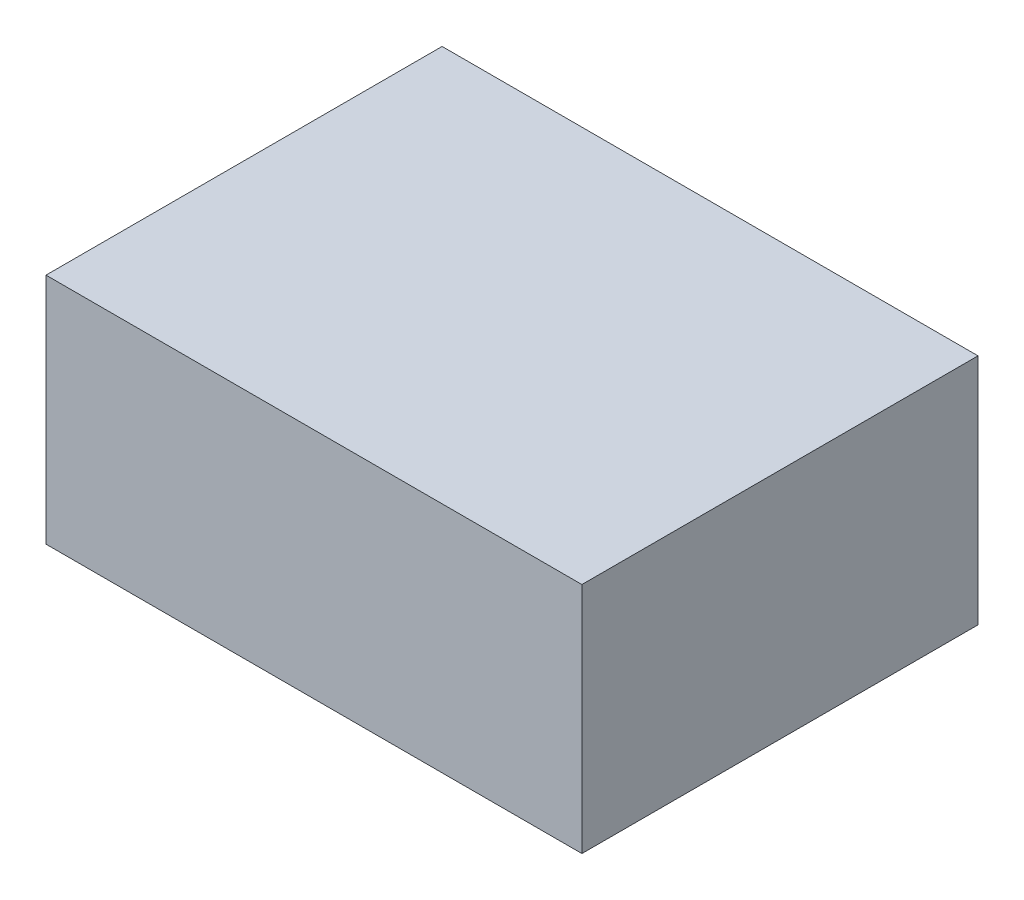
from build123d import *

# Parameters (mm, degrees)
SKETCH1_W           = 230
SKETCH1_H           = 170
BOSS_EXTRUDE1_DEPTH = 100


with BuildPart() as part:
    # Sketch1 → Boss-Extrude1 (new body)
    with BuildSketch(Plane(origin=(0, 0, 0), x_dir=(1, 0, 0), z_dir=(0, 1, 0))):
        Rectangle(SKETCH1_W, SKETCH1_H)
    extrude(amount=BOSS_EXTRUDE1_DEPTH)


solid = part.part
